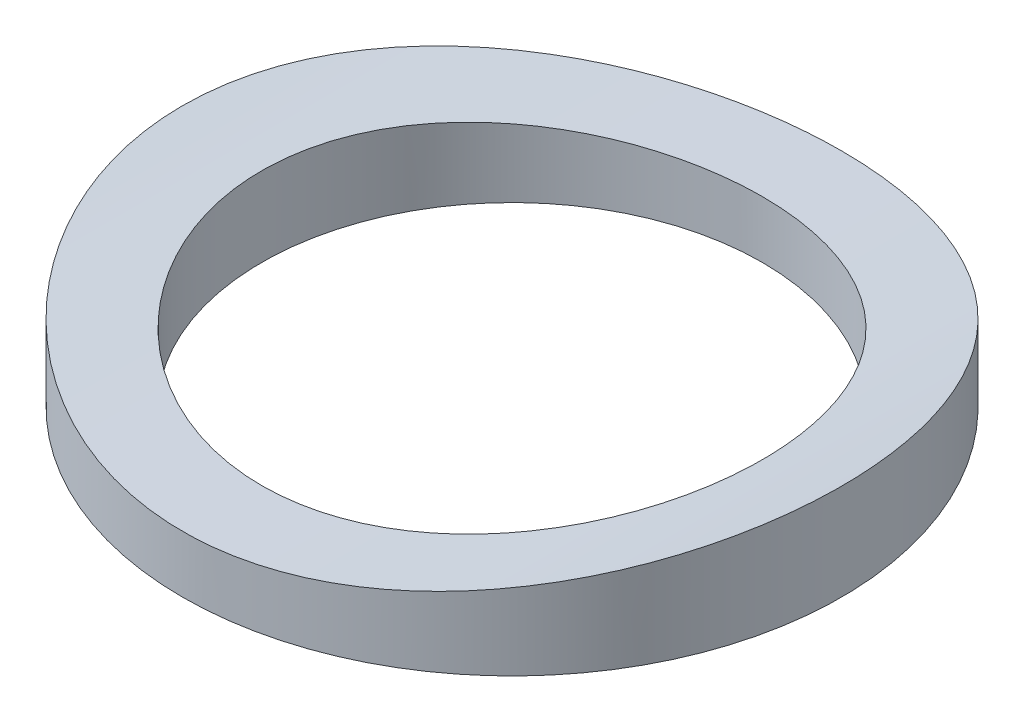
from build123d import *

# Parameters (mm, degrees)
SKETCH1_R                = 10.4
SKETCH1_R_2              = 7.9
BOSS_EXTRUDE1_DEPTH      = 3.2
SURFACE_EXTRUDE1_1_BACK  = 15
SURFACE_EXTRUDE1_1_DEPTH = 30


with BuildPart() as part:
    # Sketch1 → Boss-Extrude1 (new body)
    with BuildSketch(Plane(origin=(0, 0, 0), x_dir=(1, 0, 0), z_dir=(0, 1, 0))):
        with Locations(Location((0, 0, 0), (0, 0, 270))):
            Circle(SKETCH1_R)
        with Locations(Location((0, 0, 0), (0, 0, 270))):
            Circle(SKETCH1_R_2, mode=Mode.SUBTRACT)
    extrude(amount=BOSS_EXTRUDE1_DEPTH)

    # SurfaceCut5: cut with a surface, the side behind it stays
    # Surface-Extrude1: a surface, the sketch's curves swept straight by 30 mm
    with BuildLine(Plane.XY.offset(-SURFACE_EXTRUDE1_1_BACK), mode=Mode.PRIVATE) as surface_extrude1_1_path:
        CenterArc((0, 46.25), 44.45, 0, 360)
    surface_extrude1_1 = Shell.extrude(surface_extrude1_1_path.wire(), (0 * SURFACE_EXTRUDE1_1_DEPTH, 0 * SURFACE_EXTRUDE1_1_DEPTH, 1 * SURFACE_EXTRUDE1_1_DEPTH))
    split(bisect_by=surface_extrude1_1, keep=Keep.BOTTOM)


solid = part.part
